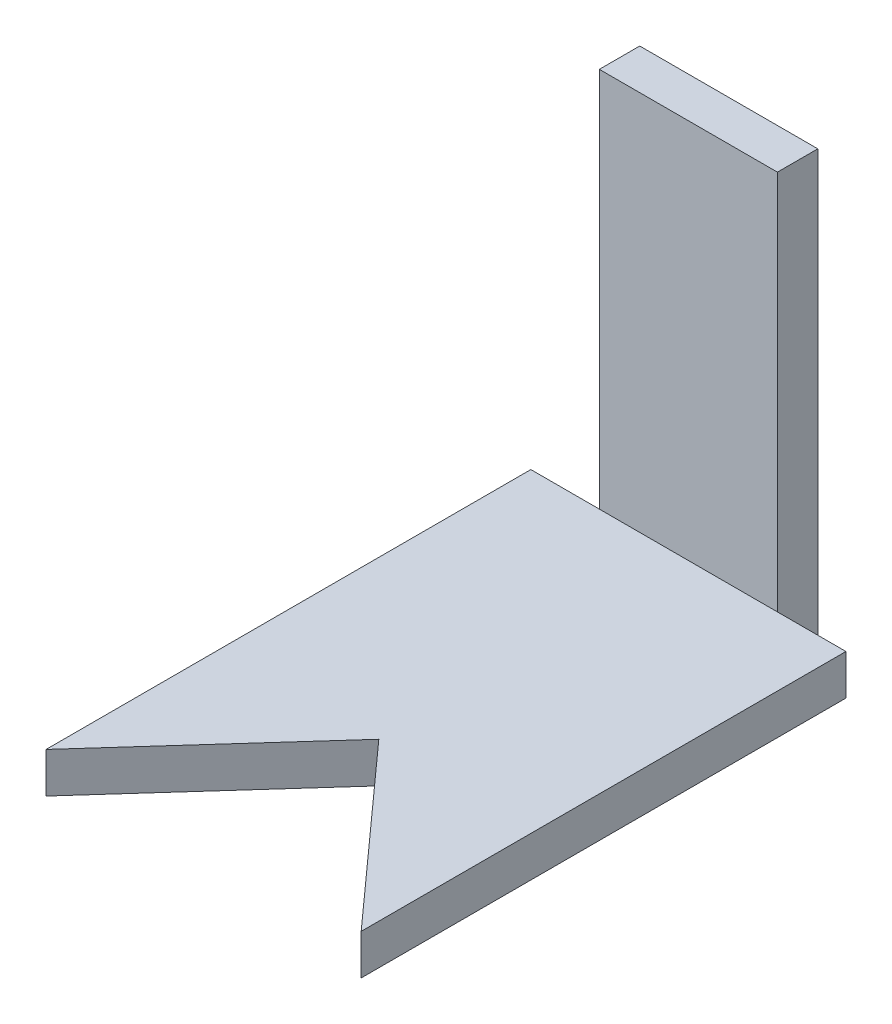
from build123d import *

# Parameters (mm, degrees)
SKETCH1_W           = 27.9908
SKETCH1_H           = 66.2178
BOSS_EXTRUDE1_DEPTH = 6.35
SKETCH4_W           = 49.53
SKETCH4_H           = 6.35
BOSS_EXTRUDE3_DEPTH = 76.2
CUT_EXTRUDE1_DEPTH  = 110.091817223


with BuildPart() as part:
    # Sketch1 → Boss-Extrude1 (new body)
    with BuildSketch(Plane.XY):
        with Locations((13.9954, 33.1089)):
            Rectangle(SKETCH1_W, SKETCH1_H)
    extrude(amount=BOSS_EXTRUDE1_DEPTH)

    # Sketch4 → Boss-Extrude3 (add)
    with BuildSketch(Plane.XY.offset(6.35)):
        with Locations((13.9954, 3.175)):
            Rectangle(SKETCH4_W, SKETCH4_H)
    extrude(amount=BOSS_EXTRUDE3_DEPTH)

    # Sketch5 → Cut-Extrude1 (cut, through all)
    with BuildSketch(Plane(origin=(0, 6.35, 0), x_dir=(1, 0, 0), z_dir=(0, 1, 0))):
        Polygon((-10.7696, -82.55), (13.9954, -55.009603144), (38.7604, -82.55), align=None)
    extrude(amount=-CUT_EXTRUDE1_DEPTH, mode=Mode.SUBTRACT)


solid = part.part
